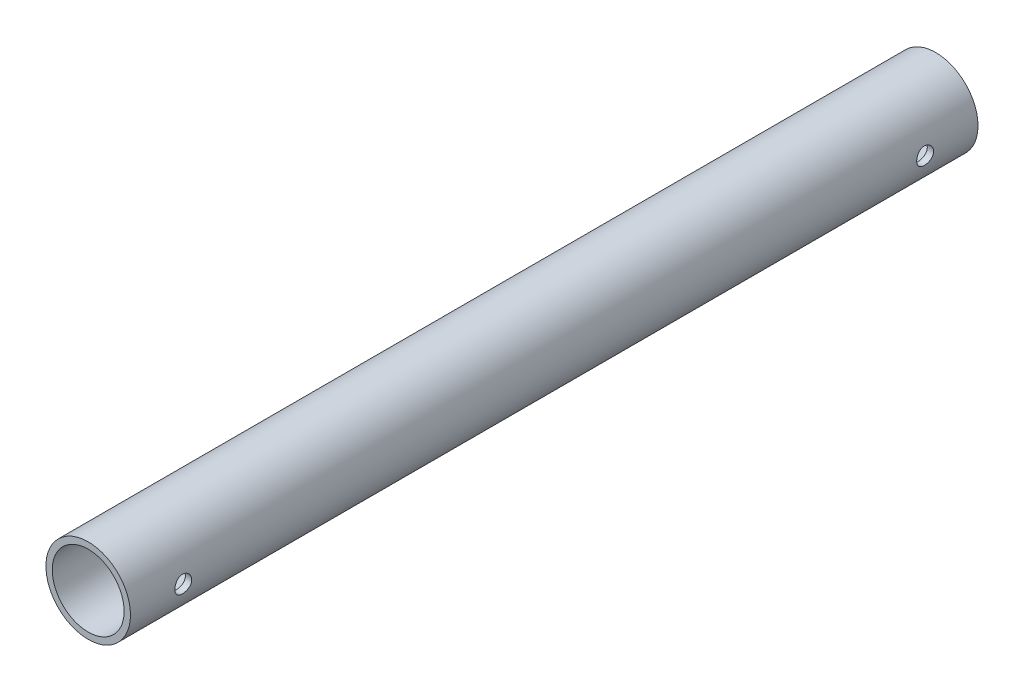
from build123d import *

# Parameters (mm, degrees)
SKETCH1_R           = 10
SKETCH1_R_2         = 8.5
BOSS_EXTRUDE1_DEPTH = 100.25
SKETCH2_R           = 2
CUT_EXTRUDE1_DEPTH  = 102.242592322


with BuildPart() as part:
    # Sketch1 → Boss-Extrude1 (new body)
    with BuildSketch(Plane.XY):
        with Locations(Location((0, 0, 0), (0, 0, 180))):
            Circle(SKETCH1_R)
        with Locations(Location((0, 0, 0), (0, 0, 180))):
            Circle(SKETCH1_R_2, mode=Mode.SUBTRACT)
    boss_extrude1 = extrude(amount=BOSS_EXTRUDE1_DEPTH)

    # Sketch2 → Cut-Extrude1 (cut, symmetric)
    with BuildSketch(Plane(origin=(0, 0, 0), x_dir=(0, 0, -1), z_dir=(1, 0, 0))):
        with Locations((-87.75, 0)):
            Circle(SKETCH2_R)
    cut_extrude1 = extrude(amount=CUT_EXTRUDE1_DEPTH, both=True, mode=Mode.SUBTRACT)

    # Mirror1: Boss-Extrude1, Cut-Extrude1 across plane
    add(boss_extrude1.mirror(Plane.XY))
    add(cut_extrude1.mirror(Plane.XY), mode=Mode.SUBTRACT)


solid = part.part
